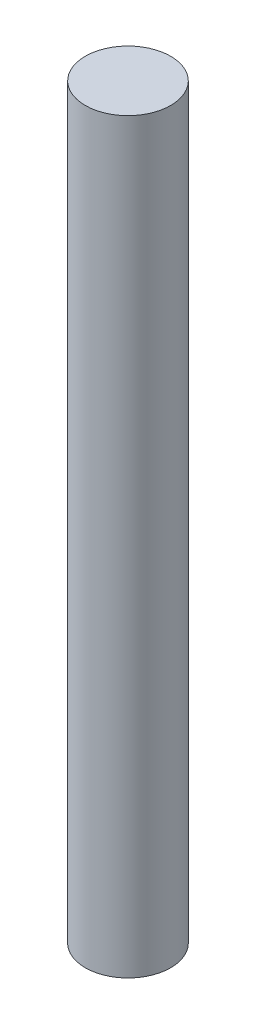
from build123d import *

# Parameters (mm, degrees)
SKETCH_1_R      = 4
EXTRUDE_1_DEPTH = 70


with BuildPart() as part:
    # 草图1 → 凸台-拉伸1 (new body)
    with BuildSketch(Plane(origin=(0, 0, 0), x_dir=(1, 0, 0), z_dir=(0, 1, 0))):
        with Locations(Location((0, 0, 0), (0, 0, 270))):
            Circle(SKETCH_1_R)
    extrude(amount=EXTRUDE_1_DEPTH)


solid = part.part
